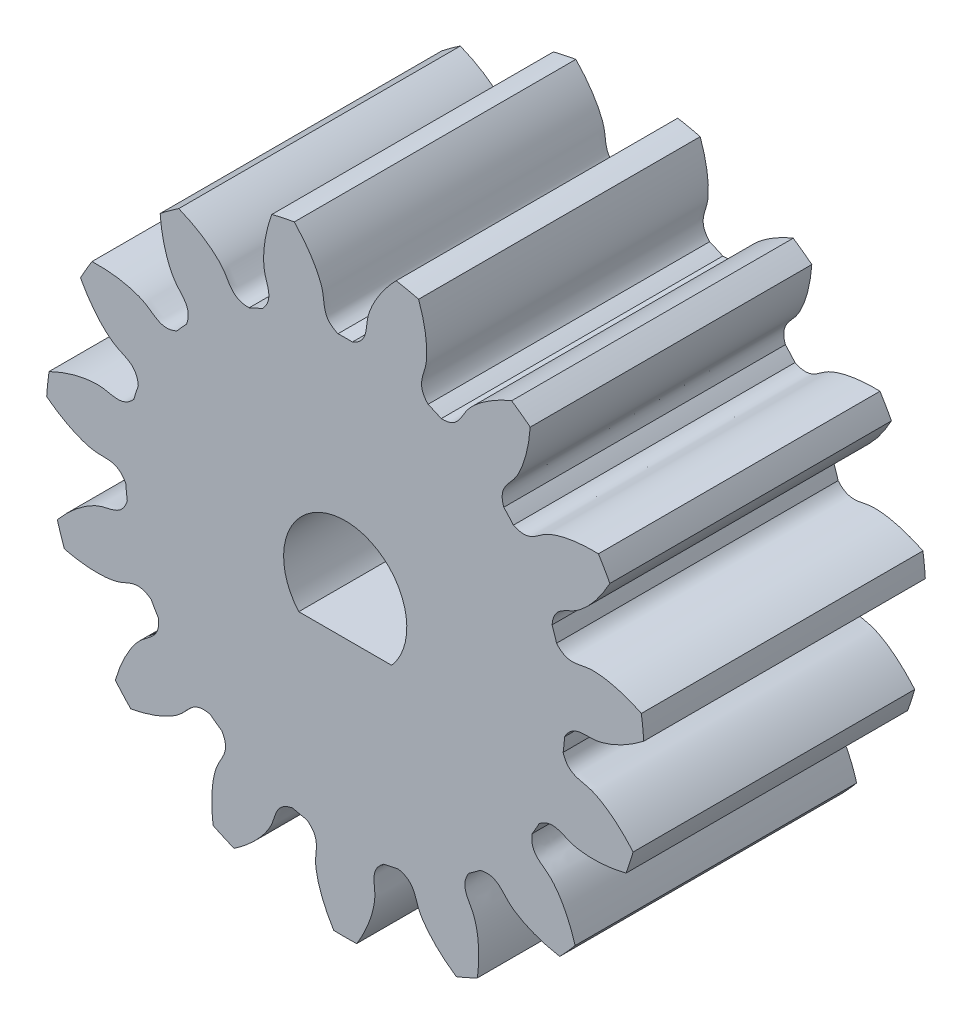
from build123d import *

# Parameters (mm, degrees)
SKETCH_1_R               = 8.5
EXTRUDE_1_DEPTH          = 8
CUT_EXTRUDE_1_DEPTH      = 15.439529078
PATTERN_CIRCULAR_1_COUNT = 15
CUT_EXTRUDE_2_DEPTH      = 6


with BuildPart() as part:
    # 草图1 → 凸台-拉伸1 (new body)
    with BuildSketch(Plane.XY):
        Circle(SKETCH_1_R)
    extrude(amount=EXTRUDE_1_DEPTH)

    # 草图2 → 切除-拉伸1 (cut, through all)
    with BuildSketch(Plane.XY):
        with BuildLine():
            ThreePointArc((0.204285041, 6.246660518), (0, 6.25), (-0.204285041, 6.246660518))
            add(Edge.make_bspline(
                [(-0.204285041, 6.246660518), (-0.657213059, 6.434410229), (-0.572113134, 6.786329423), (-0.651260487, 7.108503765), (-0.657433179, 7.131658296), (-0.664848847, 7.157393824), (-0.673610238, 7.185669304), (-0.683822401, 7.216439975), (-0.69558803, 7.249658098), (-0.709008803, 7.285272766), (-0.724184859, 7.323230017), (-0.741214851, 7.36347284), (-0.760195825, 7.405941227), (-0.781223149, 7.45057221), (-0.804390434, 7.497299909), (-0.829789451, 7.546055571), (-0.85751006, 7.596767623), (-0.88764013, 7.649361721), (-0.920265465, 7.703760798), (-0.955469731, 7.759885119), (-0.993334383, 7.817652339), (-1.033938597, 7.876977553), (-1.077359196, 7.937773363), (-1.123670587, 7.999949933), (-1.17294469, 8.06341505), (-1.225250877, 8.128074194), (-1.280655905, 8.193830599), (-1.339223857, 8.260585318), (-1.40101608, 8.328237297), (-1.466091128, 8.396683442), (-1.534504706, 8.465818692), (-1.606309612, 8.53553609), (-1.681555685, 8.60572686), (-1.760289756, 8.676280481), (-1.842555595, 8.747084764), (-1.928393867, 8.818025934), (-2.017842082, 8.888988705), (-2.110934555, 8.959856364), (-2.207702364, 9.03051085), (-2.308173306, 9.100832842), (-2.412371865, 9.170701837), (-2.520319173, 9.239996242), (-2.632032976, 9.308593453), (-2.747527609, 9.376369947), (-2.866813942, 9.44320137), (-3.032585662, 9.531768704), (-3.160151914, 9.595033966), (-3.246838389, 9.635928206)],
                knots=[0, 0, 0, 0, 0.202473101, 0.206978902, 0.212085478, 0.217792827, 0.224100949, 0.231009845, 0.238519514, 0.246629958, 0.255341174, 0.264653164, 0.274565928, 0.285079465, 0.296193776, 0.307908861, 0.320224719, 0.33314135, 0.346658755, 0.360776934, 0.375495886, 0.390815612, 0.406736111, 0.423257384, 0.440379431, 0.458102251, 0.476425844, 0.495350211, 0.514875352, 0.535001266, 0.555727954, 0.577055415, 0.59898365, 0.621512658, 0.64464244, 0.668372996, 0.692704325, 0.717636428, 0.743169304, 0.769302954, 0.796037377, 0.823372574, 0.851308544, 0.879845288, 0.908982806, 0.938721097, 1, 1, 1, 1], degree=3))
            ThreePointArc((-3.246838389, 9.635928206), (0, 10.168238388), (3.246838389, 9.635928206))
            add(Edge.make_bspline(
                [(0.204285041, 6.246660518), (0.657213059, 6.434410229), (0.572113134, 6.786329423), (0.651260487, 7.108503765), (0.657433179, 7.131658296), (0.664848847, 7.157393824), (0.673610238, 7.185669304), (0.683822401, 7.216439975), (0.69558803, 7.249658098), (0.709008803, 7.285272766), (0.724184859, 7.323230017), (0.741214851, 7.36347284), (0.760195825, 7.405941227), (0.781223149, 7.45057221), (0.804390434, 7.497299909), (0.829789451, 7.546055571), (0.85751006, 7.596767623), (0.88764013, 7.649361721), (0.920265465, 7.703760798), (0.955469731, 7.759885119), (0.993334383, 7.817652339), (1.033938597, 7.876977553), (1.077359196, 7.937773363), (1.123670587, 7.999949933), (1.17294469, 8.06341505), (1.225250877, 8.128074194), (1.280655905, 8.193830599), (1.339223857, 8.260585318), (1.40101608, 8.328237297), (1.466091128, 8.396683442), (1.534504706, 8.465818692), (1.606309612, 8.53553609), (1.681555685, 8.60572686), (1.760289756, 8.676280481), (1.842555595, 8.747084764), (1.928393867, 8.818025934), (2.017842082, 8.888988705), (2.110934555, 8.959856364), (2.207702364, 9.03051085), (2.308173306, 9.100832842), (2.412371865, 9.170701837), (2.520319173, 9.239996242), (2.632032976, 9.308593453), (2.747527609, 9.376369947), (2.866813942, 9.44320137), (3.032585662, 9.531768704), (3.160151914, 9.595033966), (3.246838389, 9.635928206)],
                knots=[0, 0, 0, 0, 0.202473101, 0.206978902, 0.212085478, 0.217792827, 0.224100949, 0.231009845, 0.238519514, 0.246629958, 0.255341174, 0.264653164, 0.274565928, 0.285079465, 0.296193776, 0.307908861, 0.320224719, 0.33314135, 0.346658755, 0.360776934, 0.375495886, 0.390815612, 0.406736111, 0.423257384, 0.440379431, 0.458102251, 0.476425844, 0.495350211, 0.514875352, 0.535001266, 0.555727954, 0.577055415, 0.59898365, 0.621512658, 0.64464244, 0.668372996, 0.692704325, 0.717636428, 0.743169304, 0.769302954, 0.796037377, 0.823372574, 0.851308544, 0.879845288, 0.908982806, 0.938721097, 1, 1, 1, 1], degree=3))
        make_face()
    cut_extrude_1 = extrude(amount=CUT_EXTRUDE_1_DEPTH, mode=Mode.SUBTRACT)

    # 阵列(圆周)1: 切除-拉伸1 ×15 about axis
    pattern_circular_1_axis = Axis((0, 0, -1.5), (0, 0, 1))
    for i in range(1, PATTERN_CIRCULAR_1_COUNT):
        add(cut_extrude_1.rotate(pattern_circular_1_axis, i * 360 / PATTERN_CIRCULAR_1_COUNT), mode=Mode.SUBTRACT)

    # 草图4 → 切除-拉伸2 (cut)
    with BuildSketch(Plane.XY.offset(8)):
        with BuildLine():
            Line((-1.319090596, -1.15), (1.319090596, -1.15))
            ThreePointArc((1.319090596, -1.15), (0, 1.75), (-1.319090596, -1.15))
        make_face()
    extrude(amount=-CUT_EXTRUDE_2_DEPTH, mode=Mode.SUBTRACT)


solid = part.part
